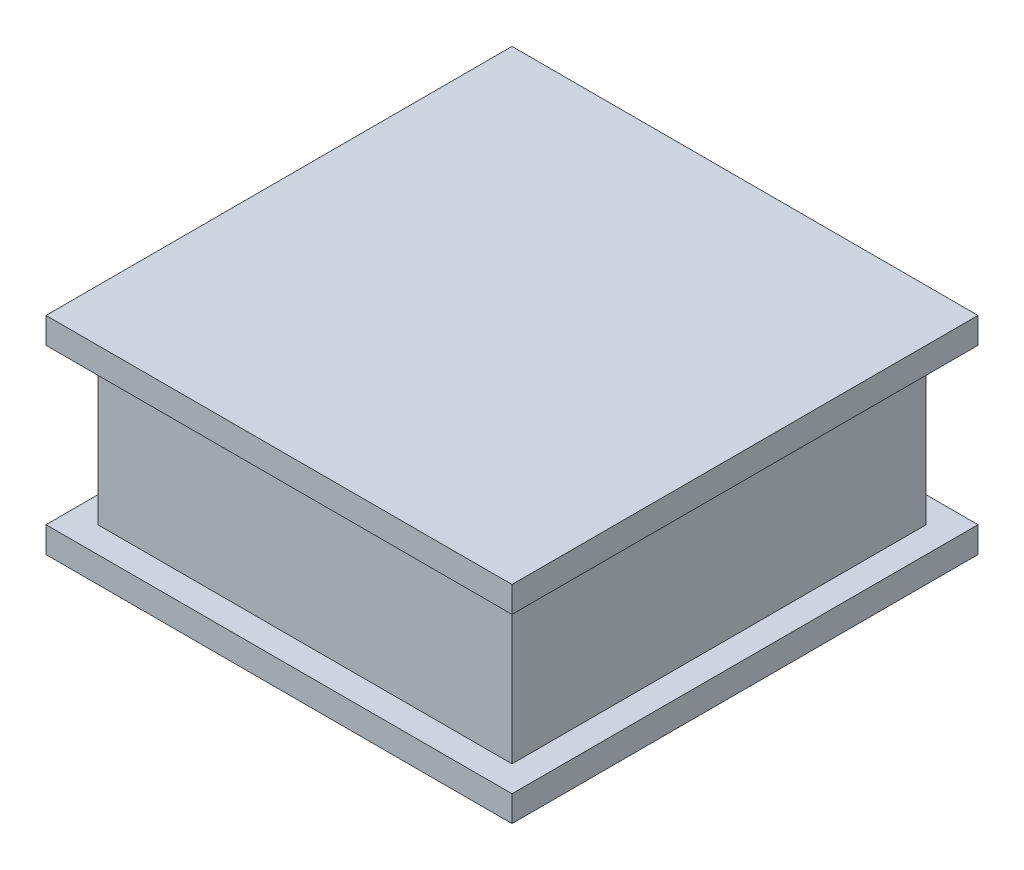
from build123d import *

# Parameters (mm, degrees)
SKETCH_1_W      = 16
SKETCH_1_H      = 16
EXTRUDE_1_DEPTH = 3
SKETCH_2_W      = 18
SKETCH_2_H      = 18
EXTRUDE_2_DEPTH = 1


with BuildPart() as part:
    # Эскиз1 → Бобышка-Вытянуть1 (new, symmetric)
    with BuildSketch(Plane(origin=(0, 0, 0), x_dir=(1, 0, 0), z_dir=(0, 1, 0))):
        Rectangle(SKETCH_1_W, SKETCH_1_H)
    extrude(amount=EXTRUDE_1_DEPTH, both=True)

    # Эскиз2 → Бобышка-Вытянуть2 (add)
    with BuildSketch(Plane(origin=(0, 3, 0), x_dir=(1, 0, 0), z_dir=(0, 1, 0))):
        Rectangle(SKETCH_2_W, SKETCH_2_H)
    extrude_2 = extrude(amount=EXTRUDE_2_DEPTH)

    # Зеркальное отражение1: Бобышка-Вытянуть2 across plane
    add(extrude_2.mirror(Plane.ZX))


solid = part.part
